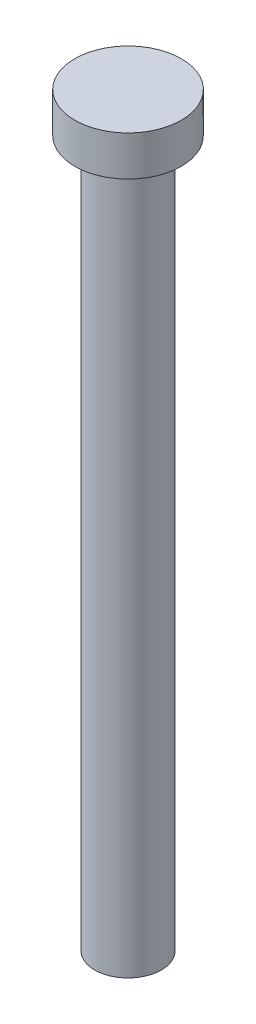
from build123d import *

# Parameters (mm, degrees)
SKETCH1_R           = 3.175
BOSS_EXTRUDE1_DEPTH = 67.31
SKETCH2_R           = 5.08
BOSS_EXTRUDE2_DEPTH = 3.81


with BuildPart() as part:
    # Sketch1 → Boss-Extrude1 (new body)
    with BuildSketch(Plane(origin=(0, 0, 0), x_dir=(1, 0, 0), z_dir=(0, 1, 0))):
        with Locations(Location((0, 0, 0), (0, 0, 270))):
            Circle(SKETCH1_R)
    extrude(amount=BOSS_EXTRUDE1_DEPTH)

    # Sketch2 → Boss-Extrude2 (add)
    with BuildSketch(Plane(origin=(0, 67.31, 0), x_dir=(1, 0, 0), z_dir=(0, 1, 0))):
        with Locations(Location((0, 0, 0), (0, 0, 90))):
            Circle(SKETCH2_R)
    extrude(amount=BOSS_EXTRUDE2_DEPTH)


solid = part.part
